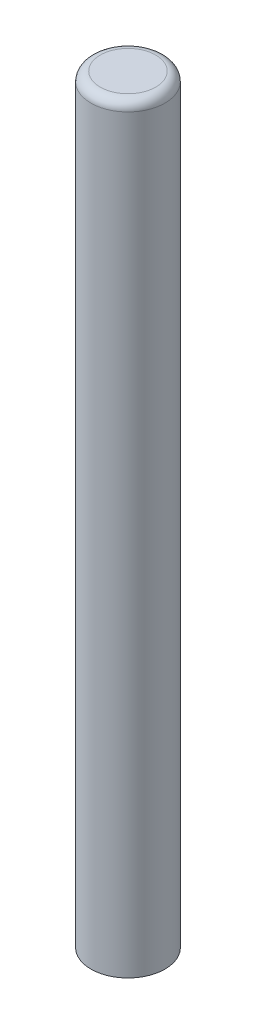
from build123d import *

# Parameters (mm, degrees)
SKETCH1_R           = 1
BOSS_EXTRUDE1_DEPTH = 20.5
FILLET1_R           = 0.25


with BuildPart() as part:
    # Sketch1 → Boss-Extrude1 (new body)
    with BuildSketch(Plane(origin=(0, 0, 0), x_dir=(1, 0, 0), z_dir=(0, 1, 0))):
        with Locations(Location((0, 0, 0), (0, 0, 270))):
            Circle(SKETCH1_R)
    extrude(amount=BOSS_EXTRUDE1_DEPTH)

    # Fillet1
    fillet1_edges = [part.edges().sort_by_distance(p)[0] for p in [
        (0, 20.5, -1),
    ]]
    fillet(fillet1_edges, radius=FILLET1_R)


solid = part.part
